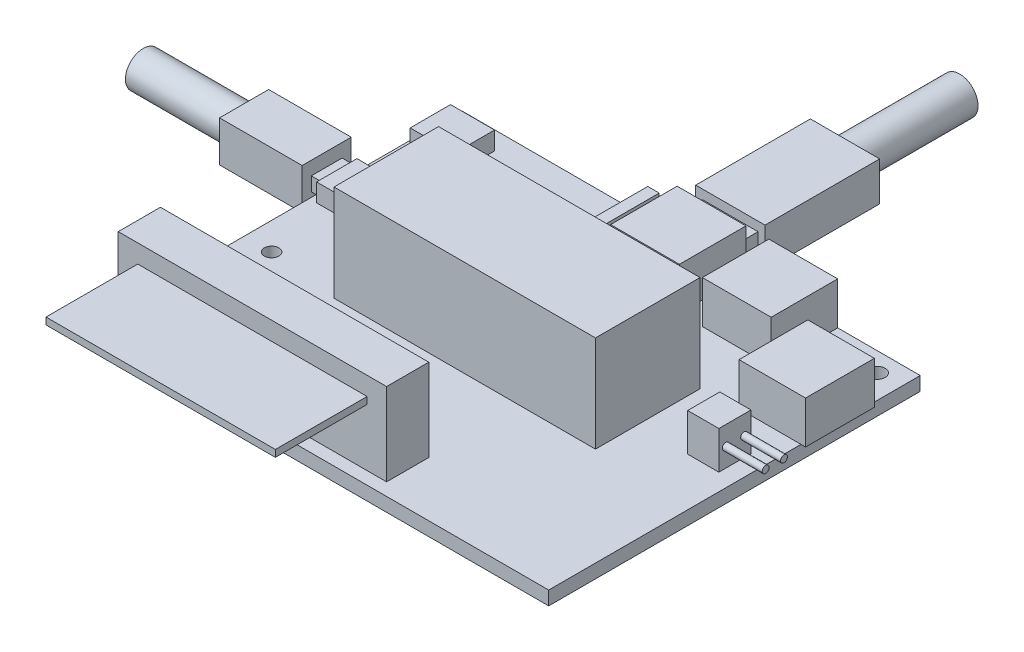
from build123d import *

# Parameters (mm, degrees)
SKETCH1_W            = 100
SKETCH1_H            = 81
SKETCH1_R            = 1.75
SKETCH1_R_2          = 1.575
BOSS_EXTRUDE1_DEPTH  = 3
SKETCH2_W            = 58.5
SKETCH2_H            = 9.2
BOSS_EXTRUDE2_DEPTH  = 18
SKETCH3_W            = 50
SKETCH3_H            = 1.5
BOSS_EXTRUDE3_DEPTH  = 20
SKETCH4_W            = 14.5
SKETCH4_H            = 15
SKETCH4_W_2          = 15
SKETCH4_H_2          = 14.5
BOSS_EXTRUDE4_DEPTH  = 9.25
SKETCH5_W            = 2.5
SKETCH5_H            = 24
BOSS_EXTRUDE5_DEPTH  = 8.5
SKETCH6_W            = 12.1
SKETCH6_H            = 4.1
BOSS_EXTRUDE6_DEPTH  = 2.25
SKETCH6_3_W          = 15.1
SKETCH6_3_H          = 25
BOSS_EXTRUDE7_DEPTH  = 4.25
SKETCH7_R            = 4
BOSS_EXTRUDE8_DEPTH  = 25
SKETCH8_W            = 9.6
SKETCH8_H            = 8.8
BOSS_EXTRUDE9_DEPTH  = 3.95
SKETCH9_W            = 2.2
SKETCH9_H            = 6.72
BOSS_EXTRUDE10_DEPTH = 1.5
SKETCH9_3_W          = 18
SKETCH9_3_H          = 10.7
BOSS_EXTRUDE11_DEPTH = 4.45
SKETCH10_R           = 3.875
BOSS_EXTRUDE12_DEPTH = 22
SKETCH11_W           = 57
SKETCH11_H           = 22.8
BOSS_EXTRUDE13_DEPTH = 21
SKETCH12_W           = 6.8
SKETCH12_H           = 7
BOSS_EXTRUDE14_DEPTH = 8.25
SKETCH13_R           = 0.75
BOSS_EXTRUDE15_DEPTH = 8.7


with BuildPart() as part:
    # Sketch1 → Boss-Extrude1 (new body)
    with BuildSketch(Plane(origin=(0, 0, 0), x_dir=(1, 0, 0), z_dir=(0, 1, 0))):
        Rectangle(SKETCH1_W, SKETCH1_H)
        with Locations(Location((44.8, 36.3, 0), (0, 0, 270))):
            Circle(SKETCH1_R, mode=Mode.SUBTRACT)
        with Locations(Location((3.8, 19.5, 0), (0, 0, 270))):
            Circle(SKETCH1_R, mode=Mode.SUBTRACT)
        with Locations(Location((-44.025, -18.275, 0), (0, 0, 270))):
            Circle(SKETCH1_R_2, mode=Mode.SUBTRACT)
        with Locations(Location((-44.025, -6.875, 0), (0, 0, 270))):
            Circle(SKETCH1_R_2, mode=Mode.SUBTRACT)
    extrude(amount=BOSS_EXTRUDE1_DEPTH)

    # Sketch2 → Boss-Extrude2 (add)
    with BuildSketch(Plane(origin=(0, 3, 0), x_dir=(1, 0, 0), z_dir=(0, 1, 0))):
        with Locations((-17.34, -33.15)):
            Rectangle(SKETCH2_W, SKETCH2_H)
    extrude(amount=BOSS_EXTRUDE2_DEPTH)

    # Sketch3 → Boss-Extrude3 (add)
    with BuildSketch(Plane.XY.offset(37.75)):
        with Locations((-17.34, 16.25)):
            Rectangle(SKETCH3_W, SKETCH3_H)
    extrude(amount=BOSS_EXTRUDE3_DEPTH)

    # Sketch4 → Boss-Extrude4 (add)
    with BuildSketch(Plane(origin=(0, 3, 0), x_dir=(1, 0, 0), z_dir=(0, 1, 0))):
        with Locations((43.75, 22)):
            Rectangle(SKETCH4_W, SKETCH4_H)
        with Locations((4.5, 33.25)):
            Rectangle(SKETCH4_W_2, SKETCH4_H_2)
        with Locations((24.5, 33.25)):
            Rectangle(SKETCH4_W_2, SKETCH4_H_2)
    extrude(amount=BOSS_EXTRUDE4_DEPTH)

    # Sketch5 → Boss-Extrude5 (add)
    with BuildSketch(Plane(origin=(0, 3, 0), x_dir=(1, 0, 0), z_dir=(0, 1, 0))):
        with Locations((-5.65, 26)):
            Rectangle(SKETCH5_W, SKETCH5_H)
    extrude(amount=BOSS_EXTRUDE5_DEPTH)

    # Sketch6 → Boss-Extrude6 (add, symmetric)
    with BuildSketch(Plane(origin=(0, 6.125, 0), x_dir=(1, 0, 0), z_dir=(0, 1, 0))):
        with Locations((4.5, 42.55)):
            Rectangle(SKETCH6_W, SKETCH6_H)
    extrude(amount=BOSS_EXTRUDE6_DEPTH, both=True)

    # Sketch6<3> → Boss-Extrude7 (add, symmetric)
    with BuildSketch(Plane(origin=(0, 6.125, 0), x_dir=(1, 0, 0), z_dir=(0, 1, 0))):
        with Locations((4.5, 57.1)):
            Rectangle(SKETCH6_3_W, SKETCH6_3_H)
    extrude(amount=BOSS_EXTRUDE7_DEPTH, both=True)

    # Sketch7 → Boss-Extrude8 (add)
    with BuildSketch(Plane(origin=(0, 0, -69.6), x_dir=(-1, 0, 0), z_dir=(0, 0, -1))):
        with Locations((-4.5, 6.125)):
            Circle(SKETCH7_R)
    extrude(amount=BOSS_EXTRUDE8_DEPTH)

    # Sketch8 → Boss-Extrude9 (add)
    with BuildSketch(Plane(origin=(0, 3, 0), x_dir=(1, 0, 0), z_dir=(0, 1, 0))):
        with Locations((-43.6, 32.1)):
            Rectangle(SKETCH8_W, SKETCH8_H)
        with Locations((-43.6, 11.7)):
            Rectangle(SKETCH8_W, SKETCH8_H)
    extrude(amount=BOSS_EXTRUDE9_DEPTH)

    # Sketch9 → Boss-Extrude10 (add, symmetric)
    with BuildSketch(Plane(origin=(0, 4.975, 0), x_dir=(1, 0, 0), z_dir=(0, 1, 0))):
        with Locations((-49.5, 11.7)):
            Rectangle(SKETCH9_W, SKETCH9_H)
    extrude(amount=BOSS_EXTRUDE10_DEPTH, both=True)

    # Sketch9<3> → Boss-Extrude11 (add, symmetric)
    with BuildSketch(Plane(origin=(0, 4.975, 0), x_dir=(1, 0, 0), z_dir=(0, 1, 0))):
        with Locations((-59.6, 11.7)):
            Rectangle(SKETCH9_3_W, SKETCH9_3_H)
    extrude(amount=BOSS_EXTRUDE11_DEPTH, both=True)

    # Sketch10 → Boss-Extrude12 (add)
    with BuildSketch(Plane.ZY.offset(68.6)):
        with Locations((-11.7, 4.975)):
            Circle(SKETCH10_R)
    extrude(amount=BOSS_EXTRUDE12_DEPTH)

    # Sketch11 → Boss-Extrude13 (add)
    with BuildSketch(Plane(origin=(0, 3, 0), x_dir=(1, 0, 0), z_dir=(0, 1, 0))):
        with Locations((0, 2.599)):
            Rectangle(SKETCH11_W, SKETCH11_H)
    extrude(amount=BOSS_EXTRUDE13_DEPTH)

    # Sketch12 → Boss-Extrude14 (add)
    with BuildSketch(Plane(origin=(0, 3, 0), x_dir=(1, 0, 0), z_dir=(0, 1, 0))):
        with Locations((42.9, 3.8)):
            Rectangle(SKETCH12_W, SKETCH12_H)
    extrude(amount=BOSS_EXTRUDE14_DEPTH)

    # Sketch13 → Boss-Extrude15 (add)
    with BuildSketch(Plane(origin=(46.3, 0, 0), x_dir=(0, 0, -1), z_dir=(1, 0, 0))):
        with Locations(Location((1.8, 7.125, 0), (0, 0, 180))):
            Circle(SKETCH13_R)
        with Locations(Location((5.8, 7.125, 0), (0, 0, 180))):
            Circle(SKETCH13_R)
    extrude(amount=BOSS_EXTRUDE15_DEPTH)


solid = part.part
